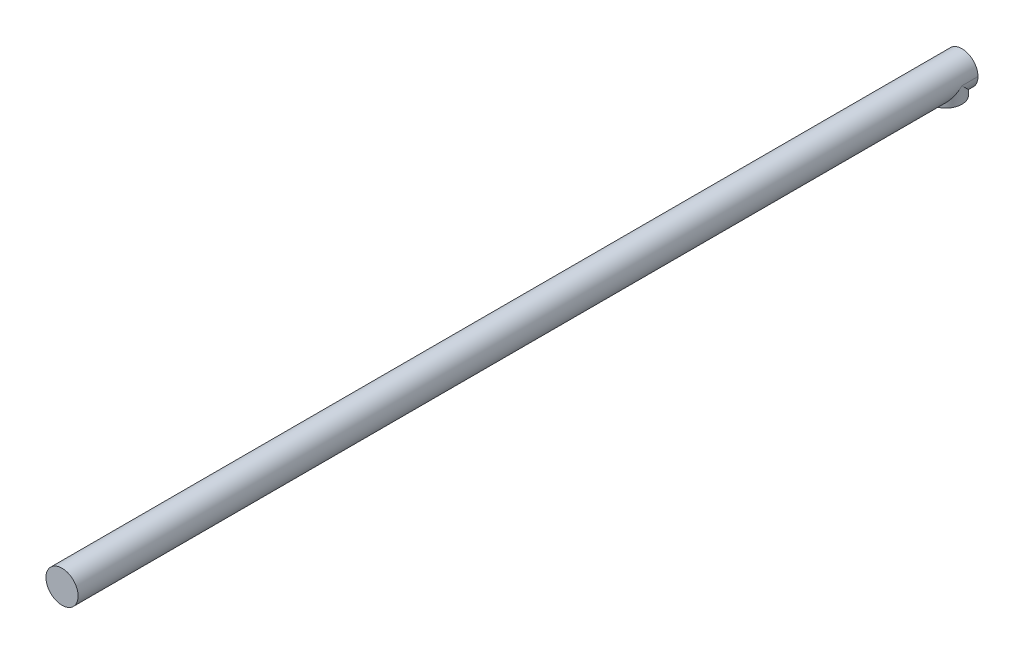
from build123d import *
from build123d.topology import SkipClean

# Parameters (mm, degrees)
SKETCH_1_R      = 2.5
EXTRUDE_1_DEPTH = 140
SKETCH_2_R      = 2.5
EXTRUDE_2_DEPTH = 2.5


with BuildPart() as part:
    # 스케치1 → 보스-돌출1 (new body)
    with BuildSketch(Plane.XY):
        Circle(SKETCH_1_R)
    extrude(amount=EXTRUDE_1_DEPTH)

    # 스케치2 → 보스-돌출2 (add)
    with SkipClean():  # the faces are left unmerged after this step: merging them gives an invalid solid
        with BuildSketch(Plane(origin=(0, 0, 0), x_dir=(1, 0, 0), z_dir=(0, 1, 0))):
            with Locations((0, -2.5)):
                Circle(SKETCH_2_R)
        extrude(amount=-EXTRUDE_2_DEPTH)


solid = part.part
